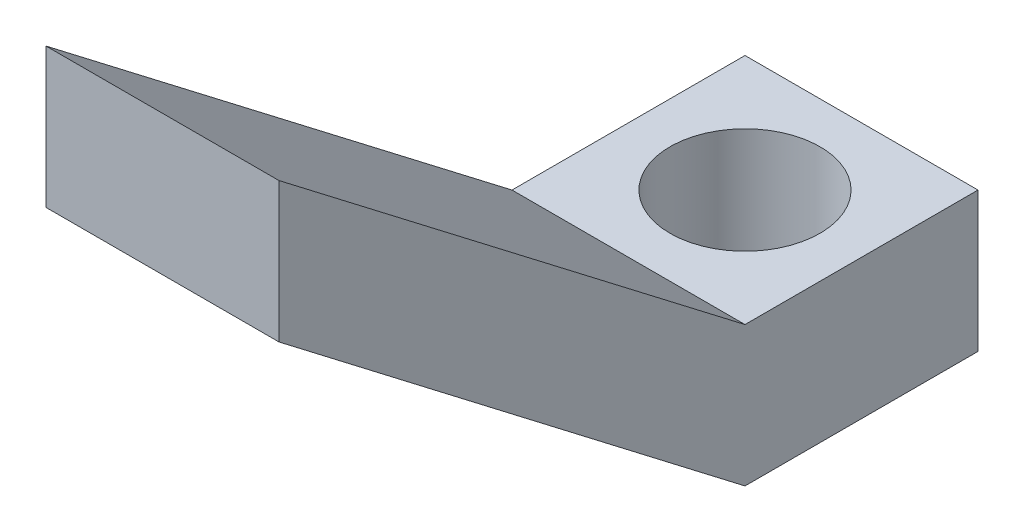
from build123d import *

# Parameters (mm, degrees)
SKETCH_1_W          = 25
SKETCH_1_H          = 25
EXTRUDE_1_DEPTH     = 15
SKETCH_2_R          = 8.05
CUT_EXTRUDE_1_DEPTH = 24.184046239
EXTRUDE_2_DEPTH     = 25


with BuildPart() as part:
    # 草图1 → 凸台-拉伸1 (new body)
    with BuildSketch(Plane(origin=(0, 0, 0), x_dir=(1, 0, 0), z_dir=(0, 1, 0))):
        Rectangle(SKETCH_1_W, SKETCH_1_H)
    extrude(amount=EXTRUDE_1_DEPTH)

    # 草图2 → 切除-拉伸1 (cut, through all)
    with BuildSketch(Plane(origin=(0, 15, 0), x_dir=(1, 0, 0), z_dir=(0, 1, 0))):
        with Locations(Location((0, 0, 0), (0, 0, 270))):
            Circle(SKETCH_2_R)
    extrude(amount=-CUT_EXTRUDE_1_DEPTH, mode=Mode.SUBTRACT)

    # 草图3 → 凸台-拉伸2 (add)
    with BuildSketch(Plane.ZY.offset(12.5)):
        Polygon((12.5, 15), (62.5, 53.379349155), (62.5, 38.379349155), (12.5, 0), align=None)
    extrude(amount=-EXTRUDE_2_DEPTH)


solid = part.part
